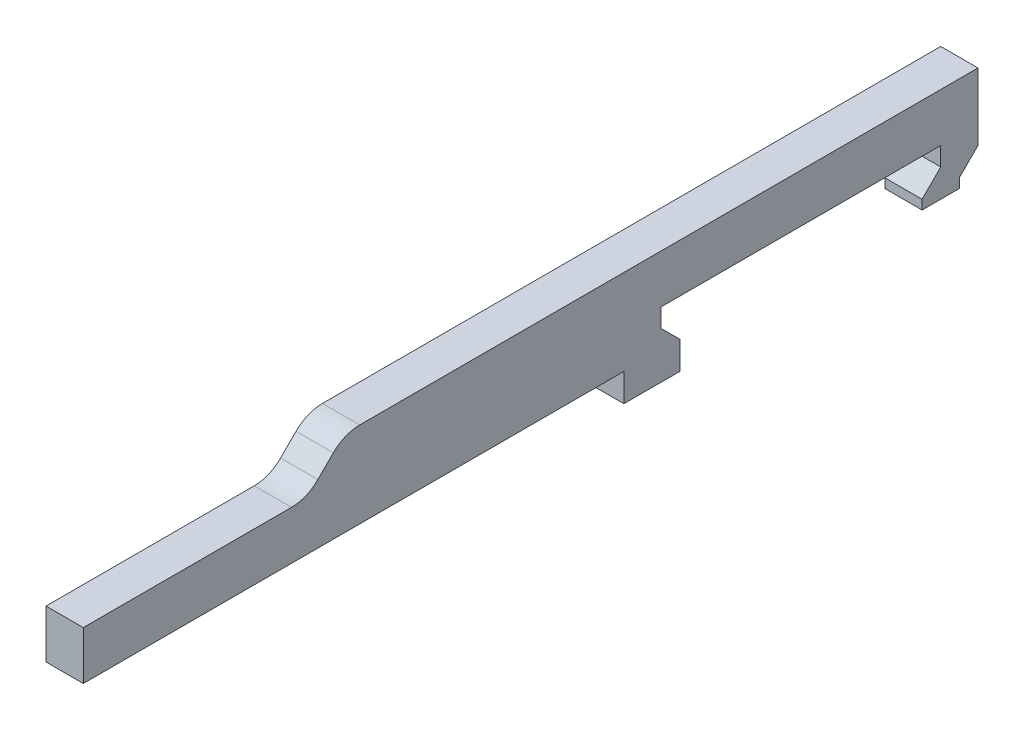
from build123d import *

# Parameters (mm, degrees)
SKETCH_1_W      = 12
SKETCH_1_H      = 2.6
EXTRUDE_1_DEPTH = 2
FILLET_1_R      = 2


with BuildPart() as part:
    # Эскиз1 → Бобышка-Вытянуть1 (new body)
    with BuildSketch(Plane(origin=(0, 0, 0), x_dir=(0, 0, -1), z_dir=(1, 0, 0))):
        Polygon((48, 1), (48, 4.6), (29, 4.6), (14, 4.6), (12, 2.6), (12, 0), (29, 0), (29, -1.5), (32, -1.5), (32, 0), (31, 1), (31, 2), (46, 2), (46, 1), (45, 0), (45, -0.5), (47, -0.5), (47, 0), align=None)
        with Locations((6, 1.3)):
            Rectangle(SKETCH_1_W, SKETCH_1_H)
    extrude(amount=EXTRUDE_1_DEPTH)

    # Скругление1
    fillet_1_edges = [part.edges().sort_by_distance(p)[0] for p in [
        (1, 2.6, -12),
        (1, 4.6, -14),
    ]]
    fillet(fillet_1_edges, radius=FILLET_1_R)


solid = part.part
